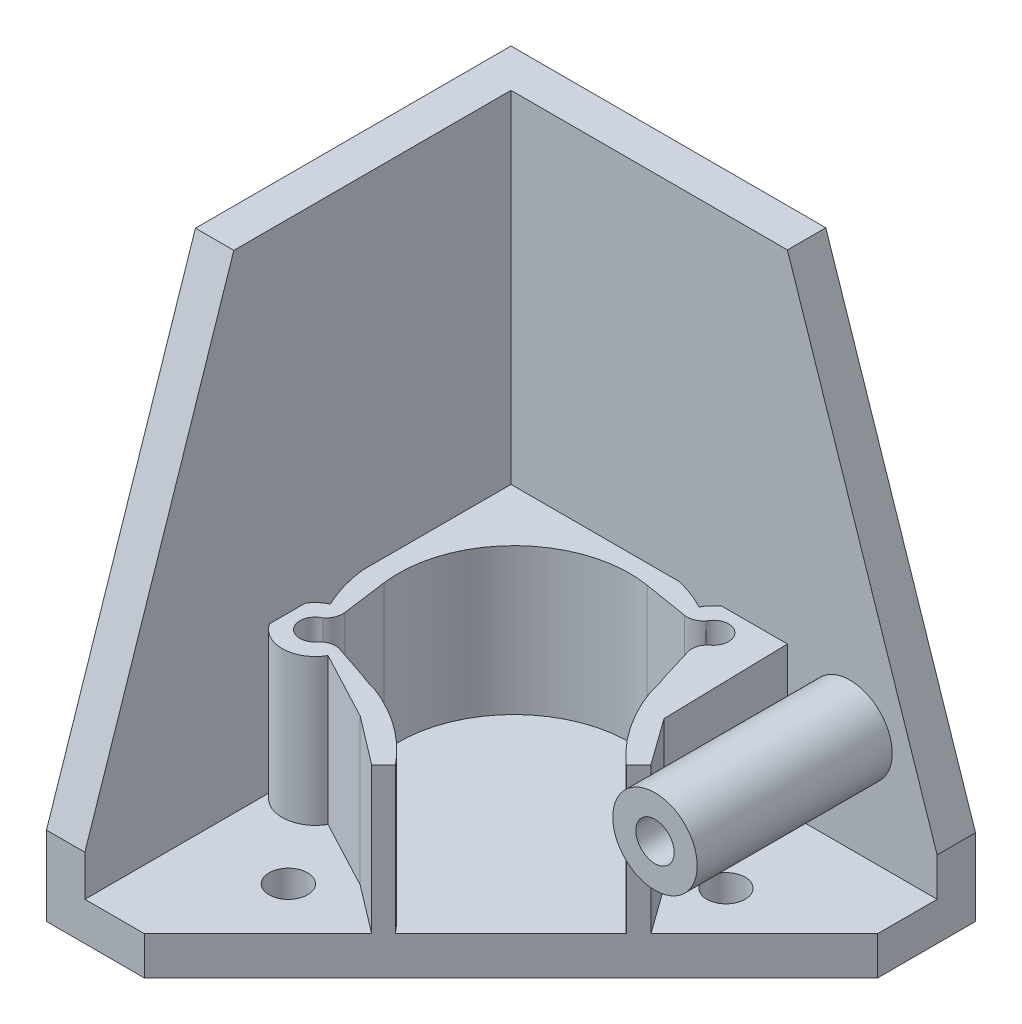
from build123d import *

# Parameters (mm, degrees)
BOSS_EXTRUDE1_DEPTH = 5
BOSS_EXTRUDE2_DEPTH = 5
BOSS_EXTRUDE3_DEPTH = 5
SKETCH6_R           = 2.5
CUT_EXTRUDE1_DEPTH  = 107.549284371
BOSS_EXTRUDE4_DEPTH = 19.05
SKETCH9_R           = 5.5
SKETCH9_R_2         = 2.5
BOSS_EXTRUDE5_DEPTH = 25.4


with BuildPart() as part:
    # Sketch1 → Boss-Extrude1 (new body)
    with BuildSketch(Plane(origin=(0, 0, 0), x_dir=(1, 0, 0), z_dir=(0, 1, 0))):
        Polygon((0, 0), (0, 60.5), (60.5, 60.5), (60.5, 47.75), (12.75, 0), align=None)
    extrude(amount=BOSS_EXTRUDE1_DEPTH)

    # Sketch4 → Boss-Extrude2 (add)
    with BuildSketch(Plane.ZY):
        Polygon((-60.5, 5), (-60.5, 68.5), (-19.4, 68.5), (0, 10.308629506), (0, 5), align=None)
    extrude(amount=-BOSS_EXTRUDE2_DEPTH)

    # Sketch5 → Boss-Extrude3 (add)
    with BuildSketch(Plane(origin=(0, 0, -60.5), x_dir=(-1, 0, 0), z_dir=(0, 0, -1))):
        Polygon((-5, 5), (-5, 68.5), (-41, 68.5), (-60.5, 10.004653177), (-60.5, 5), align=None)
    extrude(amount=-BOSS_EXTRUDE3_DEPTH)

    # Sketch6 → Cut-Extrude1 (cut, through all)
    with BuildSketch(Plane(origin=(0, 5, 0), x_dir=(1, 0, 0), z_dir=(0, 1, 0))):
        with Locations(Location((16.5, 15, 0), (0, 0, 270))):
            Circle(SKETCH6_R)
        with Locations(Location((45.5, 43, 0), (0, 0, 270))):
            Circle(SKETCH6_R)
    extrude(amount=-CUT_EXTRUDE1_DEPTH, mode=Mode.SUBTRACT)

    # Sketch7 → Boss-Extrude4 (add)
    with BuildSketch(Plane(origin=(0, 5, 0), x_dir=(1, 0, 0), z_dir=(0, 1, 0))):
        with BuildLine():
            Line((21.319247217, 19.543418849), (27.55028172, 14.80028172))
            Line((27.55028172, 14.80028172), (29.101515101, 16.351515101))
            ThreePointArc((29.101515101, 16.351515101), (24.666913521, 20.553458517), (19.305449591, 23.482062993))
            ThreePointArc((19.305449591, 23.482062993), (18.064972723, 23.830124106), (16.858784616, 24.282937146))
            Line((16.858784616, 24.282937146), (12.384629863, 25.774635894))
            ThreePointArc((12.384629863, 25.774635894), (11.23817984, 25.813438697), (10.255553875, 25.221577628))
            ThreePointArc((10.255553875, 25.221577628), (7.080749695, 25.107920962), (7.801379157, 28.201946269))
            ThreePointArc((7.801379157, 28.201946269), (8.483986824, 29.116932404), (8.624672831, 30.249787338))
            Line((8.624672831, 30.249787338), (7.827322243, 36.113739602))
            ThreePointArc((7.827322243, 36.113739602), (12.250646005, 48.939477405), (25.194853904, 53.00307497))
            Line((25.194853904, 53.00307497), (31.034265028, 52.042355532))
            ThreePointArc((31.034265028, 52.042355532), (32.170605503, 52.151365529), (33.104288638, 52.808167369))
            ThreePointArc((33.104288638, 52.808167369), (36.217223203, 53.44215303), (36.014993038, 50.271758357))
            ThreePointArc((36.014993038, 50.271758357), (35.395934706, 49.306035781), (35.402721719, 48.158949364))
            Line((35.402721719, 48.158949364), (36.768952902, 43.644900376))
            ThreePointArc((36.768952902, 43.644900376), (37.18792138, 42.426542952), (37.501221649, 41.17683405))
            ThreePointArc((37.501221649, 41.17683405), (40.195217667, 35.858711581), (44.131223781, 31.381223781))
            Line((44.131223781, 31.381223781), (45.737755925, 32.987755925))
            Line((45.737755925, 32.987755925), (41.382120343, 39.053882356))
            Line((41.382120343, 39.053882356), (41, 55.5))
            Line((41, 55.5), (32.491282289, 55.5))
            ThreePointArc((32.491282289, 55.5), (31.691168489, 54.800352321), (31.086863185, 53.925993089))
            ThreePointArc((31.086863185, 53.925993089), (29.049863177, 54.843826537), (26.91416103, 55.5))
            Line((26.91416103, 55.5), (5, 55.5))
            Line((5, 55.5), (5, 36.259130968))
            ThreePointArc((5, 36.259130968), (5.604814931, 33.17761818), (6.740301049, 30.249787338))
            ThreePointArc((6.740301049, 30.249787338), (5.763456299, 29.595667883), (5, 28.701669892))
            Line((5, 28.701669892), (5, 24.05684885))
            ThreePointArc((5, 24.05684885), (8.756409057, 22.076412717), (12.384629863, 24.282937146))
            Line((12.384629863, 24.282937146), (21.319247217, 19.543418849))
        make_face()
    extrude(amount=BOSS_EXTRUDE4_DEPTH)

    # Sketch9 → Boss-Extrude5 (add)
    with BuildSketch(Plane.XY.offset(-55.5)):
        with Locations(Location((49.152306284, 18.55, 0), (0, 0, 180))):
            Circle(SKETCH9_R)
        with Locations((49.152306284, 18.55)):
            Circle(SKETCH9_R_2, mode=Mode.SUBTRACT)
    extrude(amount=BOSS_EXTRUDE5_DEPTH)


solid = part.part
